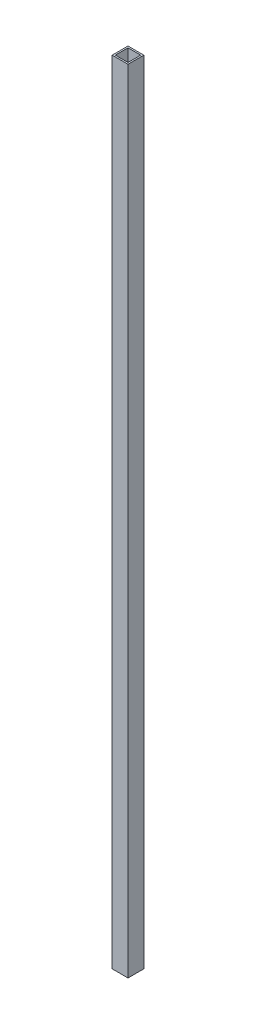
from build123d import *

# Parameters (mm, degrees)
SKETCH1_W           = 20
SKETCH1_H           = 20
SKETCH1_W_2         = 16
SKETCH1_H_2         = 16
BOSS_EXTRUDE1_DEPTH = 1000


with BuildPart() as part:
    # Sketch1 → Boss-Extrude1 (new body)
    with BuildSketch(Plane(origin=(0, 0, 0), x_dir=(1, 0, 0), z_dir=(0, 1, 0))):
        with Locations((10, 10)):
            Rectangle(SKETCH1_W, SKETCH1_H)
        with Locations((10, 10)):
            Rectangle(SKETCH1_W_2, SKETCH1_H_2, mode=Mode.SUBTRACT)
    extrude(amount=BOSS_EXTRUDE1_DEPTH)


solid = part.part
